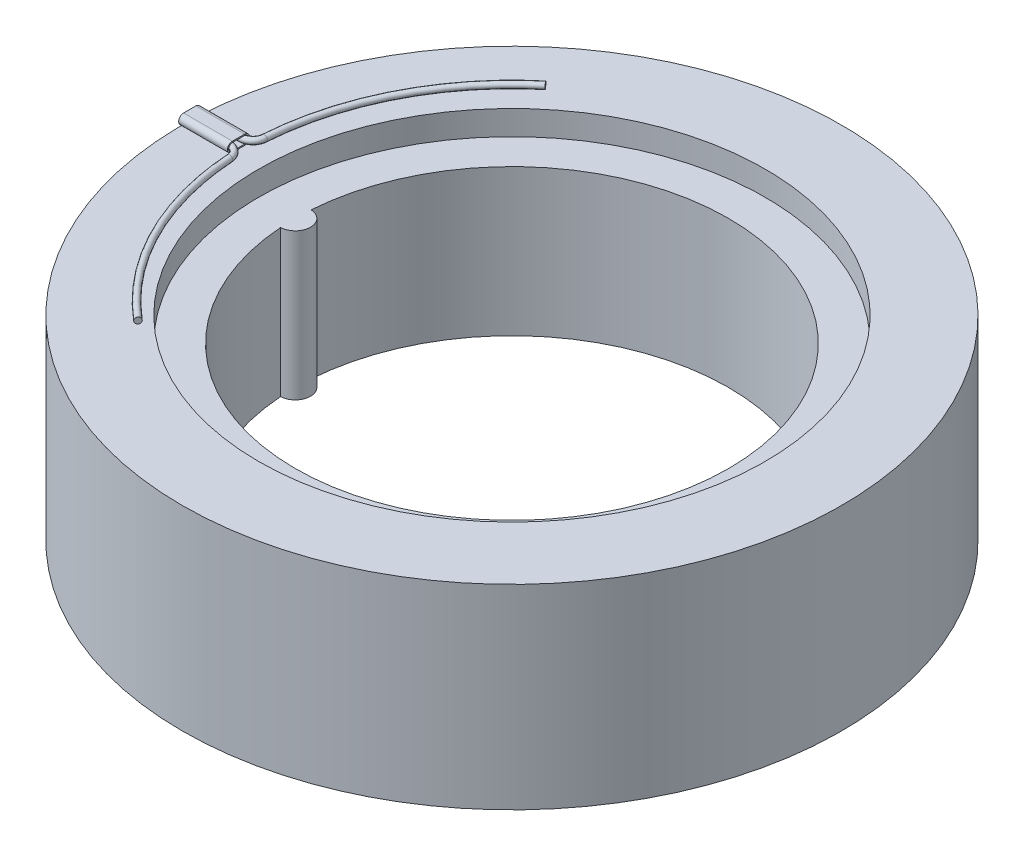
from build123d import *

# Parameters (mm, degrees)
SKETCH1_W                       = 3
SKETCH1_H                       = 12
SKETCH2_W                       = 6.25
SKETCH2_H                       = 16
BOSS_EXTRUDE1_REACH             = 41.013
SKETCH3_R                       = 1.25
BOSS_EXTRUDE1_DIRECTION_2_REACH = 41.013
SWEEP1_PROFILE_R                = 0.25
EXTRUDE_THIN1_START             = -22.4
EXTRUDE_THIN1_DEPTH             = 4


with BuildPart() as part:
    # Sketch1 → Revolve1 (revolve)
    with BuildSketch(Plane.XY):
        with Locations((-19.25, 0)):
            Rectangle(SKETCH1_W, SKETCH1_H)
    revolve(axis=Axis((0, 0, 0), (0, -1, 0)))

    # Boss-Extrude1: up to this face of the body (flat: up to its plane)
    boss_extrude1_end = Plane(part.part.faces().sort_by_distance((20.163101372, 6, 0))[0])
    # Sketch3 → Boss-Extrude1 (add, up to the picked face)
    with BuildSketch(Plane(origin=(0, 0, 0), x_dir=(1, 0, 0), z_dir=(0, 1, 0)), mode=Mode.PRIVATE) as boss_extrude1_sk1:
        with Locations((-17.75, 0)):
            Circle(SKETCH3_R)
    boss_extrude1_tool1 = split(extrude(boss_extrude1_sk1.sketch, amount=BOSS_EXTRUDE1_REACH, mode=Mode.PRIVATE), bisect_by=boss_extrude1_end, keep=Keep.BOTH, mode=Mode.PRIVATE)
    add(boss_extrude1_tool1.solids().sort_by(Axis((-17.75, 0, 0), (0, 1, 0)))[0])

    # Boss-Extrude1 direction 2: up to this face of the body (flat: up to its plane)
    boss_extrude1_direction_2_end = Plane(part.part.faces().sort_by_distance((18.336898628, -6, 0))[0])
    # Sketch3 → Boss-Extrude1 direction 2 (add, up to the picked face)
    with BuildSketch(Plane(origin=(0, 0, 0), x_dir=(1, 0, 0), z_dir=(0, 1, 0)), mode=Mode.PRIVATE) as boss_extrude1_direction_2_sk1:
        with Locations((-17.75, 0)):
            Circle(SKETCH3_R)
    boss_extrude1_direction_2_tool1 = split(extrude(boss_extrude1_direction_2_sk1.sketch, amount=-BOSS_EXTRUDE1_DIRECTION_2_REACH, mode=Mode.PRIVATE), bisect_by=boss_extrude1_direction_2_end, keep=Keep.BOTH, mode=Mode.PRIVATE)
    add(boss_extrude1_direction_2_tool1.solids().sort_by(Axis((-17.75, 0, 0), (0, -1, 0)))[0])


with BuildPart() as body_2:
    # Sketch2 → Revolve2 (revolve)
    with BuildSketch(Plane.XY):
        with Locations((-23.875, 0)):
            Rectangle(SKETCH2_W, SKETCH2_H)
    revolve(axis=Axis((0, 0, 0), (0, -1, 0)))


with BuildPart() as body_3:
    # Sweep1: sweep along a path in Sketch4
    with BuildLine(Plane(origin=(0, 9, 0), x_dir=(1, 0, 0), z_dir=(0, 1, 0))) as sweep1_path:
        Line((-25.807382336, 0.5), (-22.700495589, 0.5))
        ThreePointArc((-22.700495589, 0.5), (-22.017097486, 0.769954088), (-21.702671607, 1.434065934))
        ThreePointArc((-21.702671607, 1.434065934), (-19.388013922, 9.857353405), (-13.945888, 16.690557447))
    # Sweep1 profile (on start of the path) → Sweep1 (sweep)
    with BuildSketch(Plane(origin=(-25.807382336, 9, -0.5), x_dir=(0, 0, 1), z_dir=(1, 0, 0))):
        Circle(SWEEP1_PROFILE_R)
    sweep(path=sweep1_path.line)


with BuildPart() as body_4:
    # Mirror2: mirrored copy
    add(body_3.part.mirror(Plane.XY))


with BuildPart() as body_5:
    # Sketch23 → Extrude-Thin1 (new body)
    with BuildSketch(Plane(origin=(0, 0, 0), x_dir=(0, 0, -1), z_dir=(1, 0, 0)).offset(EXTRUDE_THIN1_START)):
        with BuildLine():
            Line((-0.5, 9.403274162), (0.5, 9.403274162))
            ThreePointArc((0.5, 9.403274162), (0.903274162, 9), (0.5, 8.596725838))
            Line((0.5, 8.596725838), (-0.5, 8.596725838))
            ThreePointArc((-0.5, 8.596725838), (-0.903274162, 9), (-0.5, 9.403274162))
        make_face()
        with BuildLine():
            Line((-0.5, 9.303274162), (0.5, 9.303274162))
            ThreePointArc((0.5, 9.303274162), (0.803274162, 9), (0.5, 8.696725838))
            Line((0.5, 8.696725838), (-0.5, 8.696725838))
            ThreePointArc((-0.5, 8.696725838), (-0.803274162, 9), (-0.5, 9.303274162))
        make_face(mode=Mode.SUBTRACT)
    extrude(amount=-EXTRUDE_THIN1_DEPTH)


solid = Compound([part.part, body_2.part, body_3.part, body_4.part, body_5.part])
